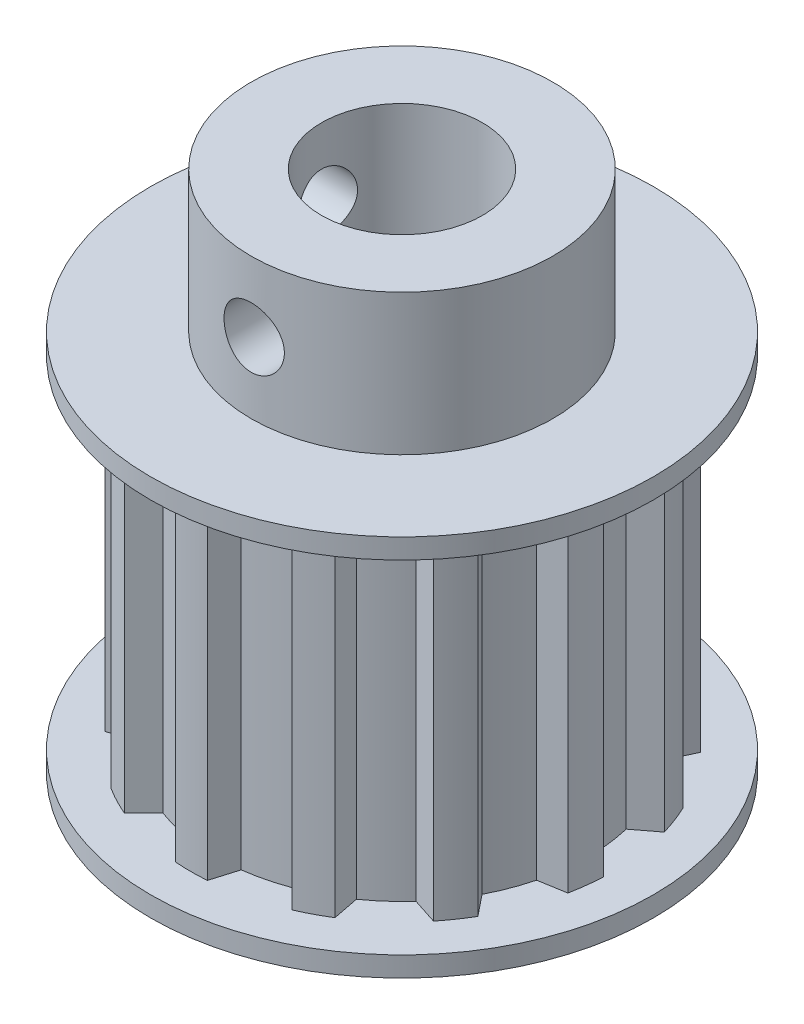
from build123d import *

# Parameters (mm, degrees)
CROQUIS1_R              = 12.5
SALIENTE_EXTRUIR1_DEPTH = 1
CROQUIS3_R              = 10.5
SALIENTE_EXTRUIR2_DEPTH = 17
CORTAR_EXTRUIR1_START   = -17
CORTAR_EXTRUIR1_DEPTH   = 17
MATRIZC1_COUNT          = 13
CROQUIS6_R              = 12.5
SALIENTE_EXTRUIR3_DEPTH = 1
CROQUIS7_R              = 7.5
SALIENTE_EXTRUIR4_DEPTH = 7
CROQUIS11_R             = 4
CORTAR_EXTRUIR2_DEPTH   = 37
CROQUIS9_R              = 1.5
CORTAR_EXTRUIR3_DEPTH   = 7
CROQUIS10_R             = 1.5
CORTAR_EXTRUIR4_DEPTH   = 7


with BuildPart() as part:
    # Croquis1 → Saliente-Extruir1 (new body)
    with BuildSketch(Plane(origin=(0, 0, 0), x_dir=(1, 0, 0), z_dir=(0, 1, 0))):
        with Locations(Location((0, 0, 0), (0, 0, 270))):
            Circle(CROQUIS1_R)
    extrude(amount=SALIENTE_EXTRUIR1_DEPTH)

    # Croquis3 → Saliente-Extruir2 (add)
    with BuildSketch(Plane(origin=(0, 1, 0), x_dir=(1, 0, 0), z_dir=(0, 1, 0))):
        with Locations(Location((0, 0, 0), (0, 0, 270))):
            Circle(CROQUIS3_R)
    extrude(amount=SALIENTE_EXTRUIR2_DEPTH)

    # Croquis5 → Cortar-Extruir1 (cut)
    with BuildSketch(Plane(origin=(0, 18, 0), x_dir=(1, 0, 0), z_dir=(0, 1, 0)).offset(CORTAR_EXTRUIR1_START)):
        with BuildLine():
            ThreePointArc((-1.05, 9.190212185), (-0.525850402, 9.23504095), (0, 9.25))
            ThreePointArc((0, 9.25), (0.525850402, 9.23504095), (1.05, 9.190212185))
            Line((1.05, 9.190212185), (1.735075677, 10.35565123))
            ThreePointArc((1.735075677, 10.35565123), (0, 10.5), (-1.735075677, 10.35565123))
            Line((-1.735075677, 10.35565123), (-1.05, 9.190212185))
        make_face()
    cortar_extruir1 = extrude(amount=CORTAR_EXTRUIR1_DEPTH, mode=Mode.SUBTRACT)

    # MatrizC1: Cortar-Extruir1 ×13 about axis
    matrizc1_axis = Axis((0, 0, 0), (0, 1, 0))
    for i in range(1, MATRIZC1_COUNT):
        add(cortar_extruir1.rotate(matrizc1_axis, i * 360 / MATRIZC1_COUNT), mode=Mode.SUBTRACT)

    # Croquis6 → Saliente-Extruir3 (add)
    with BuildSketch(Plane(origin=(0, 18, 0), x_dir=(1, 0, 0), z_dir=(0, 1, 0))):
        with Locations(Location((0, 0, 0), (0, 0, 270))):
            Circle(CROQUIS6_R)
    extrude(amount=SALIENTE_EXTRUIR3_DEPTH)

    # Croquis7 → Saliente-Extruir4 (add)
    with BuildSketch(Plane(origin=(0, 19, 0), x_dir=(1, 0, 0), z_dir=(0, 1, 0))):
        with Locations(Location((0, 0, 0), (0, 0, 270))):
            Circle(CROQUIS7_R)
    extrude(amount=SALIENTE_EXTRUIR4_DEPTH)

    # Croquis11 → Cortar-Extruir2 (cut)
    with BuildSketch(Plane(origin=(0, 26, 0), x_dir=(1, 0, 0), z_dir=(0, 1, 0))):
        with Locations(Location((0, 0, 0), (0, 0, 270))):
            Circle(CROQUIS11_R)
    extrude(amount=-CORTAR_EXTRUIR2_DEPTH, mode=Mode.SUBTRACT)

    # Croquis9 → Cortar-Extruir3 (cut)
    with BuildSketch(Plane(origin=(0, 26, 7.5), x_dir=(1, 0, 0), z_dir=(0, 0, 1))):
        with Locations(Location((0, -3.5, 0), (0, 0, 270))):
            Circle(CROQUIS9_R)
    extrude(amount=-CORTAR_EXTRUIR3_DEPTH, mode=Mode.SUBTRACT)

    # Croquis10 → Cortar-Extruir4 (cut)
    with BuildSketch(Plane(origin=(-7.5, 26, 0), x_dir=(0, 0, 1), z_dir=(-1, 0, 0))):
        with Locations((0, -3.5)):
            Circle(CROQUIS10_R)
    extrude(amount=-CORTAR_EXTRUIR4_DEPTH, mode=Mode.SUBTRACT)


solid = part.part
